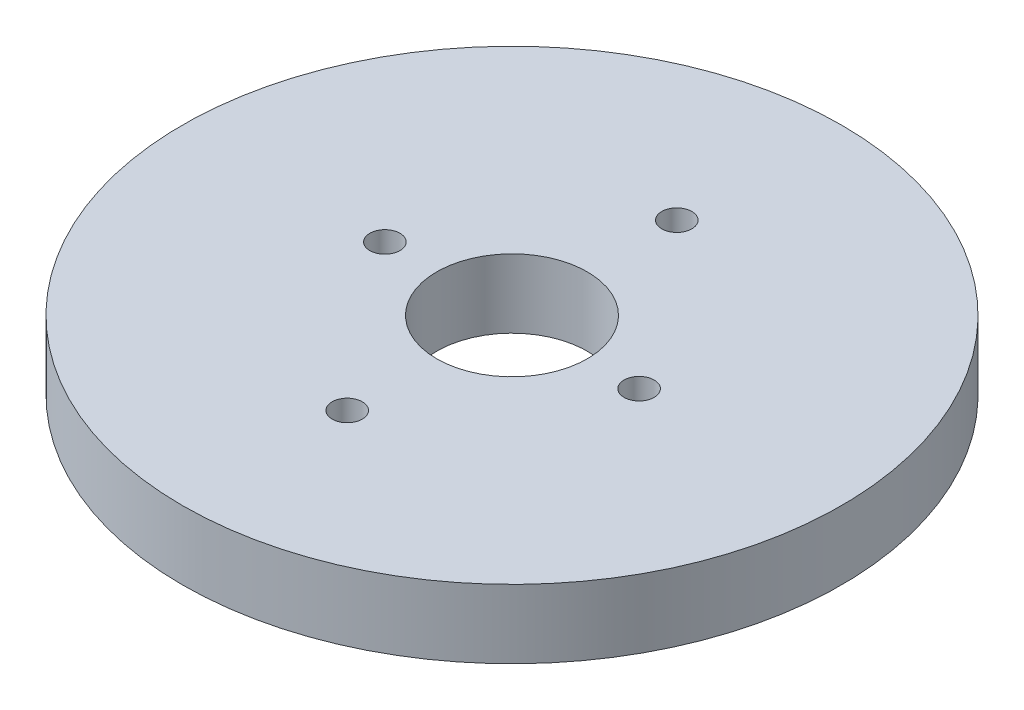
from build123d import *

# Parameters (mm, degrees)
SKETCH1_R           = 17.5
SKETCH1_R_2         = 4
SKETCH1_R_3         = 0.8
BOSS_EXTRUDE1_DEPTH = 3.65


with BuildPart() as part:
    # Sketch1 → Boss-Extrude1 (new body)
    with BuildSketch(Plane(origin=(0, 0, 0), x_dir=(1, 0, 0), z_dir=(0, 1, 0))):
        with Locations(Location((0, 0, 0), (0, 0, 270))):
            Circle(SKETCH1_R)
        with Locations(Location((0, 0, 0), (0, 0, 270))):
            Circle(SKETCH1_R_2, mode=Mode.SUBTRACT)
        with Locations(Location((-6.75, 0, 0), (0, 0, 270))):
            Circle(SKETCH1_R_3, mode=Mode.SUBTRACT)
        with Locations(Location((0, -8.75, 0), (0, 0, 270))):
            Circle(SKETCH1_R_3, mode=Mode.SUBTRACT)
        with Locations(Location((6.75, 0, 0), (0, 0, 270))):
            Circle(SKETCH1_R_3, mode=Mode.SUBTRACT)
        with Locations(Location((0, 8.75, 0), (0, 0, 270))):
            Circle(SKETCH1_R_3, mode=Mode.SUBTRACT)
    extrude(amount=BOSS_EXTRUDE1_DEPTH)


solid = part.part
